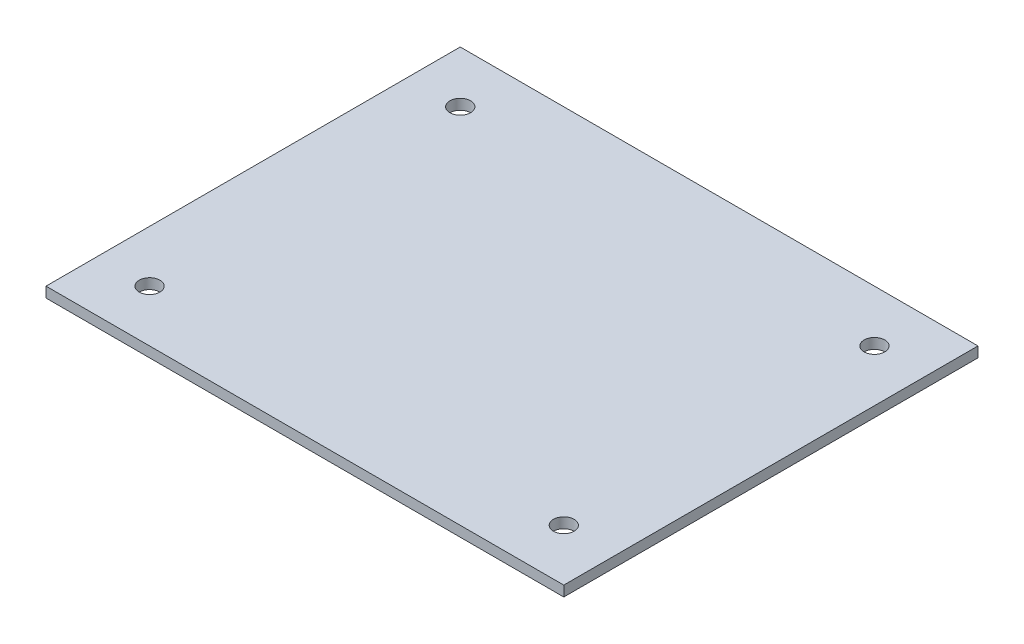
from build123d import *

# Parameters (mm, degrees)
SKETCH1_W           = 250
SKETCH1_H           = 200
BOSS_EXTRUDE1_DEPTH = 5
SKETCH3_R           = 5
HOLES_DEPTH         = 161.15617378


with BuildPart() as part:
    # Sketch1 → Boss-Extrude1 (new body)
    with BuildSketch(Plane(origin=(0, 0, 0), x_dir=(1, 0, 0), z_dir=(0, 1, 0))):
        Rectangle(SKETCH1_W, SKETCH1_H)
    extrude(amount=BOSS_EXTRUDE1_DEPTH)

    # Sketch3 → holes (cut, through all)
    with BuildSketch(Plane(origin=(0, 0, 0), x_dir=(1, 0, 0), z_dir=(0, 1, 0))):
        with Locations(Location((-100, 75, 0), (0, 0, 270))):
            Circle(SKETCH3_R)
        with Locations(Location((100, 75, 0), (0, 0, 90))):
            Circle(SKETCH3_R)
        with Locations(Location((100, -75, 0), (0, 0, 270))):
            Circle(SKETCH3_R)
        with Locations(Location((-100, -75, 0), (0, 0, 90))):
            Circle(SKETCH3_R)
    extrude(amount=HOLES_DEPTH, mode=Mode.SUBTRACT)


solid = part.part
